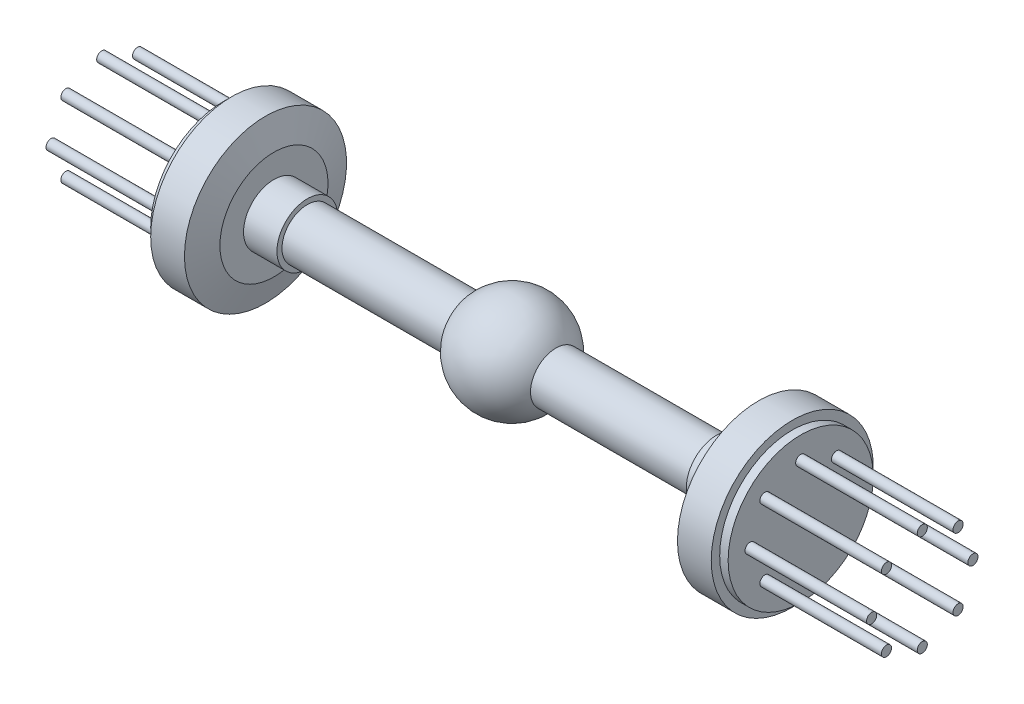
from build123d import *

# Parameters (mm, degrees)
SKETCH2_R           = 15
BOSS_EXTRUDE1_DEPTH = 360


with BuildPart() as part:
    # Sketch1 → Revolve1 (revolve)
    with BuildSketch(Plane.XY, mode=Mode.PRIVATE) as revolve1_sk:
        with BuildLine():
            Line((-855, 0), (-855, 215))
            Line((-855, 215), (-830, 215))
            Line((-830, 215), (-830, 240))
            Line((-830, 240), (-730, 240))
            Line((-730, 240), (-705, 160))
            Line((-705, 160), (-705, 90))
            Line((-705, 90), (-606.156213382, 90))
            Line((-606.156213382, 90), (-606.156213382, 75))
            Line((-606.156213382, 75), (-129.903810568, 75))
            ThreePointArc((-129.903810568, 75), (0, 150), (129.903810568, 75))
            Line((129.903810568, 75), (606.156213382, 75))
            Line((606.156213382, 75), (606.156213382, 90))
            Line((606.156213382, 90), (705, 90))
            Line((705, 90), (705, 160))
            Line((705, 160), (730, 240))
            Line((730, 240), (830, 240))
            Line((830, 240), (830, 215))
            Line((830, 215), (855, 215))
            Line((855, 215), (855, 0))
            Line((855, 0), (-855, 0))
        make_face()
    revolve(revolve1_sk.sketch.rotate(Axis((-1250, 0, 0), (1, 0, 0)), 90), axis=Axis((-1250, 0, 0), (1, 0, 0)))

    # Sketch2 → Boss-Extrude1 (add)
    with BuildSketch(Plane.ZY.offset(855)):
        with Locations(Location((0, 150, 0), (0, 0, 180))):
            Circle(SKETCH2_R)
        with Locations(Location((106.066017178, 106.066017178, 0), (0, 0, 180))):
            Circle(SKETCH2_R)
        with Locations(Location((150, 0, 0), (0, 0, 180))):
            Circle(SKETCH2_R)
        with Locations(Location((106.066017178, -106.066017178, 0), (0, 0, 180))):
            Circle(SKETCH2_R)
        with Locations(Location((0, -150, 0), (0, 0, 180))):
            Circle(SKETCH2_R)
        with Locations(Location((-106.066017178, -106.066017178, 0), (0, 0, 180))):
            Circle(SKETCH2_R)
        with Locations(Location((-150, 0, 0), (0, 0, 180))):
            Circle(SKETCH2_R)
        with Locations(Location((-106.066017178, 106.066017178, 0), (0, 0, 180))):
            Circle(SKETCH2_R)
    boss_extrude1 = extrude(amount=BOSS_EXTRUDE1_DEPTH)

    # Mirror1: Boss-Extrude1 across plane
    add(boss_extrude1.mirror(Plane(origin=(0, 0, 0), x_dir=(0, 0, 1), z_dir=(1, 0, 0))))


solid = part.part
